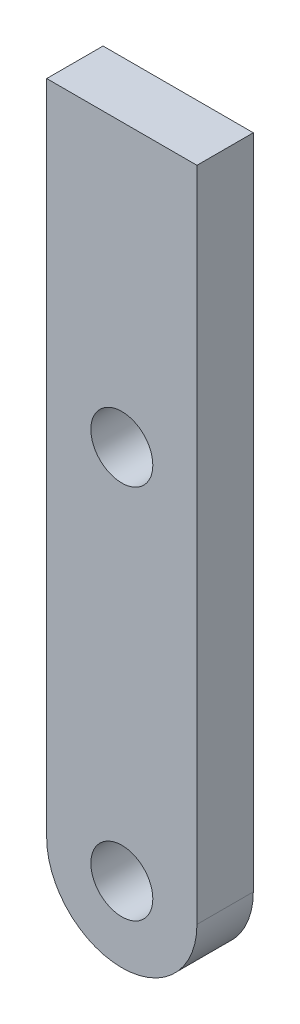
from build123d import *

# Parameters (mm, degrees)
SKETCH_1_R      = 1.65
EXTRUDE_1_DEPTH = 3
EXTRUDE_START   = -3
EXTRUDE_2_DEPTH = 3


with BuildPart() as part:
    # 草图1 → 凸台-拉伸1 (new body)
    with BuildSketch(Plane.XY):
        with BuildLine():
            Line((4, 10), (4, -10))
            ThreePointArc((4, -10), (0, -14), (-4, -10))
            Line((-4, -10), (-4, 10))
            ThreePointArc((-4, 10), (0, 14), (4, 10))
        make_face()
        with Locations((0, 10)):
            Circle(SKETCH_1_R, mode=Mode.SUBTRACT)
        with Locations((0, -10)):
            Circle(SKETCH_1_R, mode=Mode.SUBTRACT)
    extrude(amount=EXTRUDE_1_DEPTH)

    # 草图2 → 凸台-拉伸2 (add)
    with BuildSketch(Plane.XY.offset(3).offset(EXTRUDE_START)):
        with BuildLine():
            Line((-4, 10), (-4, 25))
            Line((-4, 25), (4, 25))
            Line((4, 25), (4, 10))
            ThreePointArc((4, 10), (0, 14), (-4, 10))
        make_face()
    extrude(amount=EXTRUDE_2_DEPTH)


solid = part.part
